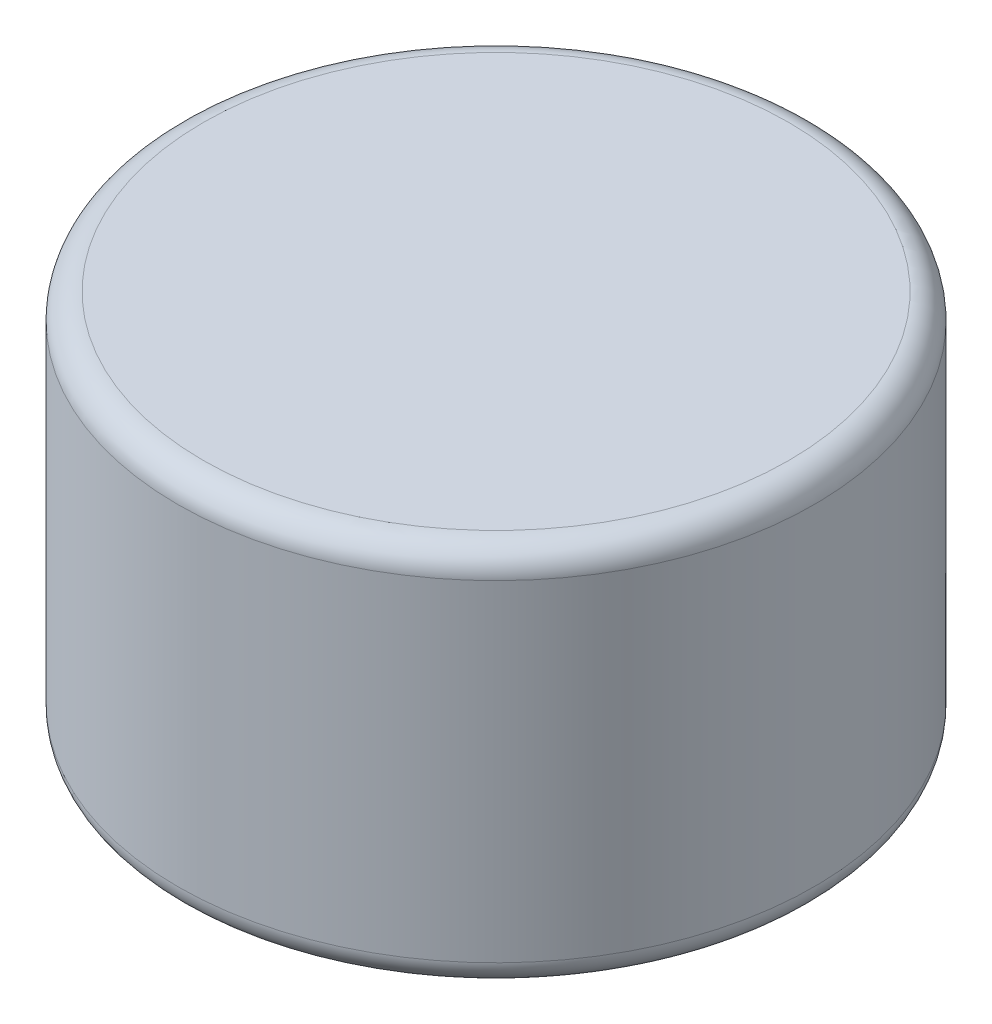
from build123d import *

# Parameters (mm, degrees)
SKETCH1_R           = 2.5
BOSS_EXTRUDE1_DEPTH = 3
FILLET1_R           = 0.2


with BuildPart() as part:
    # Sketch1 → Boss-Extrude1 (new body)
    with BuildSketch(Plane(origin=(0, 0, 0), x_dir=(1, 0, 0), z_dir=(0, 1, 0))):
        with Locations(Location((0, 0, 0), (0, 0, 270))):
            Circle(SKETCH1_R)
    extrude(amount=BOSS_EXTRUDE1_DEPTH)

    # Fillet1
    fillet1_edges = [part.edges().sort_by_distance(p)[0] for p in [
        (0, 0, -2.5),
        (0, 3, -2.5),
    ]]
    fillet(fillet1_edges, radius=FILLET1_R)


solid = part.part
